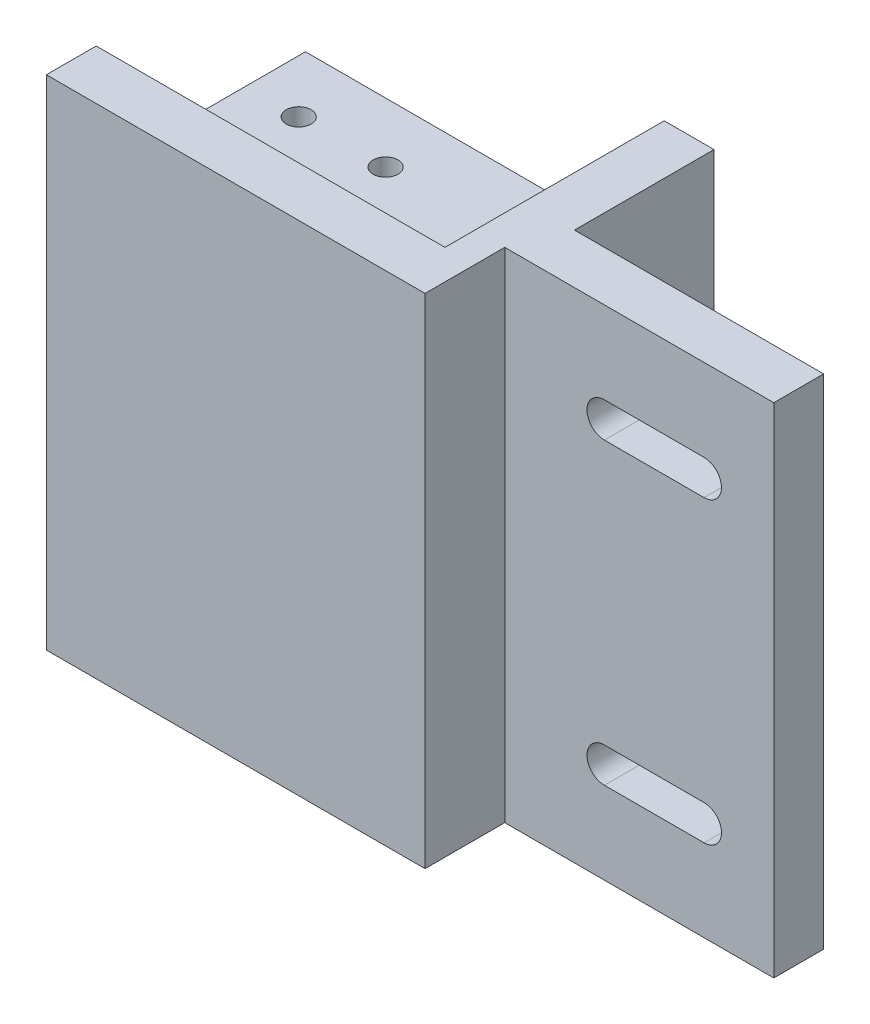
from build123d import *

# Parameters (mm, degrees)
SKETCH1_W                       = 100
SKETCH1_H                       = 50
BOSS_EXTRUDE1_DEPTH             = 5
SKETCH2_W                       = 5
SKETCH2_H                       = 50
BOSS_EXTRUDE2_DEPTH             = 22
SKETCH5_W                       = 25
SKETCH5_H                       = 4
BOSS_EXTRUDE3_DEPTH             = 16
SKETCH6_R                       = 1.25
HOLES_TO_FIX_LEVEL_SWITCH_DEPTH = 40
SKETCH10_W                      = 25
SKETCH10_H                      = 50
BOSS_EXTRUDE4_DEPTH             = 8
CUT_EXTRUDE2_DEPTH              = 61.074953184
CUT_EXTRUDE2_DEPTH_BACK         = 61.074953184
SKETCH9_W                       = 35
SKETCH9_H                       = 50
CUT_EXTRUDE3_DEPTH              = 10
SKETCH11_W                      = 27
SKETCH11_H                      = 50
CUT_EXTRUDE4_DEPTH              = 8


with BuildPart() as part:
    # Sketch1 → Boss-Extrude1 (new body)
    with BuildSketch(Plane.XY):
        Rectangle(SKETCH1_W, SKETCH1_H)
    extrude(amount=BOSS_EXTRUDE1_DEPTH)

    # Sketch2 → Boss-Extrude2 (add)
    with BuildSketch(Plane.XY):
        with Locations((22.5, 0)):
            Rectangle(SKETCH2_W, SKETCH2_H)
    extrude(amount=-BOSS_EXTRUDE2_DEPTH)

    # Sketch5 → Boss-Extrude3 (add)
    with BuildSketch(Plane.XY):
        with Locations((2.5, 17)):
            Rectangle(SKETCH5_W, SKETCH5_H)
    extrude(amount=-BOSS_EXTRUDE3_DEPTH)

    # Sketch6 → Holes-to-fix-level-switch (cut)
    with BuildSketch(Plane(origin=(0, 19, 0), x_dir=(1, 0, 0), z_dir=(0, 1, 0))):
        with Locations(Location((-4.68, 10, 0), (0, 0, 270))):
            Circle(SKETCH6_R)
        with Locations(Location((4.04, 10, 0), (0, 0, 270))):
            Circle(SKETCH6_R)
    extrude(amount=-HOLES_TO_FIX_LEVEL_SWITCH_DEPTH, mode=Mode.SUBTRACT)

    # Sketch10 → Boss-Extrude4 (add)
    with BuildSketch(Plane(origin=(0, 0, 0), x_dir=(-1, 0, 0), z_dir=(0, 0, -1))):
        with Locations((-37.5, 0)):
            Rectangle(SKETCH10_W, SKETCH10_H)
    extrude(amount=BOSS_EXTRUDE4_DEPTH)

    # Sketch8 → Cut-Extrude2 (cut, two sides: drawn at the far end of the back side and taken through both)
    with BuildSketch(Plane.XY.offset(-CUT_EXTRUDE2_DEPTH_BACK)):
        with BuildLine():
            Line((33, 16.75), (43, 16.75))
            ThreePointArc((43, 16.75), (44.75, 15), (43, 13.25))
            Line((43, 13.25), (33, 13.25))
            ThreePointArc((33, 13.25), (31.25, 15), (33, 16.75))
        make_face()
        with BuildLine():
            Line((33, -13.25), (43, -13.25))
            ThreePointArc((43, -13.25), (44.75, -15), (43, -16.75))
            Line((43, -16.75), (33, -16.75))
            ThreePointArc((33, -16.75), (31.25, -15), (33, -13.25))
        make_face()
    extrude(amount=CUT_EXTRUDE2_DEPTH + CUT_EXTRUDE2_DEPTH_BACK, mode=Mode.SUBTRACT)

    # Sketch9 → Cut-Extrude3 (cut)
    with BuildSketch(Plane(origin=(0, 0, 0), x_dir=(-1, 0, 0), z_dir=(0, 0, -1))):
        with Locations((32.5, 0)):
            Rectangle(SKETCH9_W, SKETCH9_H)
    extrude(amount=-CUT_EXTRUDE3_DEPTH, mode=Mode.SUBTRACT)

    # Sketch11 → Cut-Extrude4 (cut)
    with BuildSketch(Plane.XY.offset(5)):
        with Locations((36.5, 0)):
            Rectangle(SKETCH11_W, SKETCH11_H)
    extrude(amount=-CUT_EXTRUDE4_DEPTH, mode=Mode.SUBTRACT)


solid = part.part
